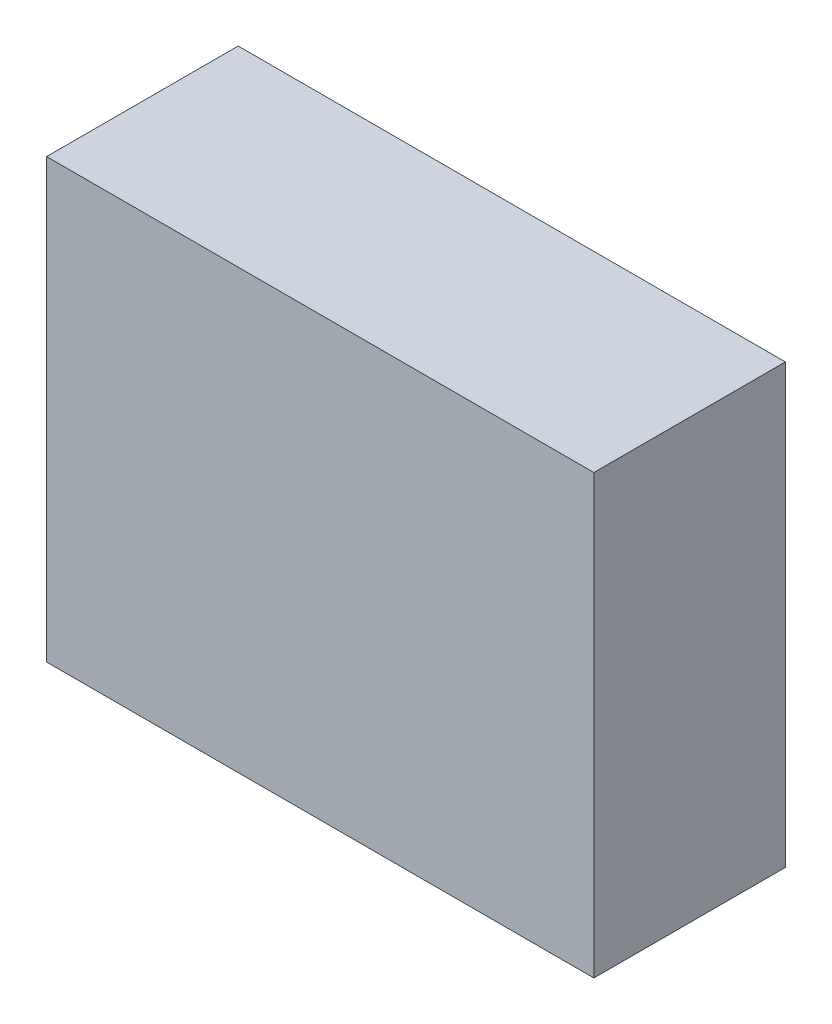
from build123d import *

# Parameters (mm, degrees)
SENSOR_ENVELOPE_5X4X1P75_START     = -22.55
SENSOR_ENVELOPE_5X4X1P75_PROFILE_W = 5
SENSOR_ENVELOPE_5X4X1P75_PROFILE_H = 4
SENSOR_ENVELOPE_5X4X1P75_DEPTH     = 1.75


with BuildPart() as part:
    # Sensor_envelope_5x4x1p75_Profile → Sensor_envelope_5x4x1p75 (new body)
    with BuildSketch(Plane.XY.offset(SENSOR_ENVELOPE_5X4X1P75_START)):
        with Locations((12.5, 0)):
            Rectangle(SENSOR_ENVELOPE_5X4X1P75_PROFILE_W, SENSOR_ENVELOPE_5X4X1P75_PROFILE_H)
    extrude(amount=SENSOR_ENVELOPE_5X4X1P75_DEPTH)


solid = part.part
